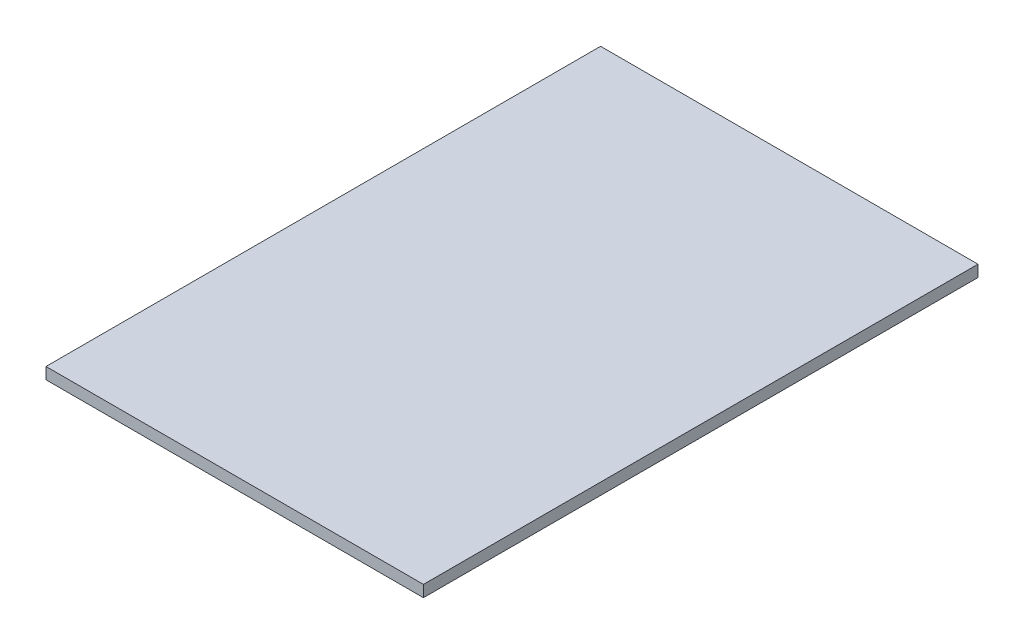
from build123d import *

# Parameters (mm, degrees)
SKETCH3_W           = 49
SKETCH3_H           = 72
BOSS_EXTRUDE1_DEPTH = 1.5


with BuildPart() as part:
    # Sketch3 → Boss-Extrude1 (new body)
    with BuildSketch(Plane(origin=(0, 0, 0), x_dir=(1, 0, 0), z_dir=(0, 1, 0))):
        with Locations((24.5, 36)):
            Rectangle(SKETCH3_W, SKETCH3_H)
    extrude(amount=BOSS_EXTRUDE1_DEPTH)


solid = part.part
